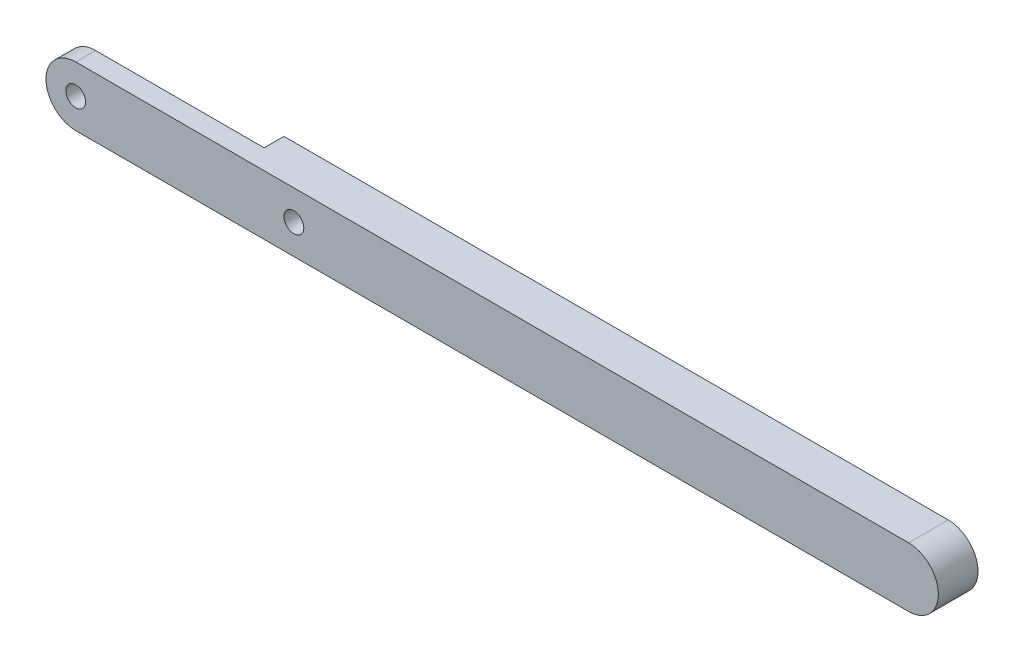
from build123d import *

# Parameters (mm, degrees)
SKETCH1_R           = 5
BOSS_EXTRUDE1_DEPTH = 10
SKETCH2_W           = 100
SKETCH2_H           = 30
CUT_EXTRUDE1_DEPTH  = 436.373402954


with BuildPart() as part:
    # Sketch1 → Boss-Extrude1 (new, symmetric)
    with BuildSketch(Plane.XY):
        with BuildLine():
            Line((0, 15), (420, 15))
            ThreePointArc((420, 15), (435, 0), (420, -15))
            Line((420, -15), (0, -15))
            ThreePointArc((0, -15), (-15, 0), (0, 15))
        make_face()
        Circle(SKETCH1_R, mode=Mode.SUBTRACT)
        with Locations((110, 0)):
            Circle(SKETCH1_R, mode=Mode.SUBTRACT)
    extrude(amount=BOSS_EXTRUDE1_DEPTH, both=True)

    # Sketch2 → Cut-Extrude1 (cut, through all)
    with BuildSketch(Plane.XY):
        with Locations((35, 0)):
            Rectangle(SKETCH2_W, SKETCH2_H)
    extrude(amount=-CUT_EXTRUDE1_DEPTH, mode=Mode.SUBTRACT)


solid = part.part
